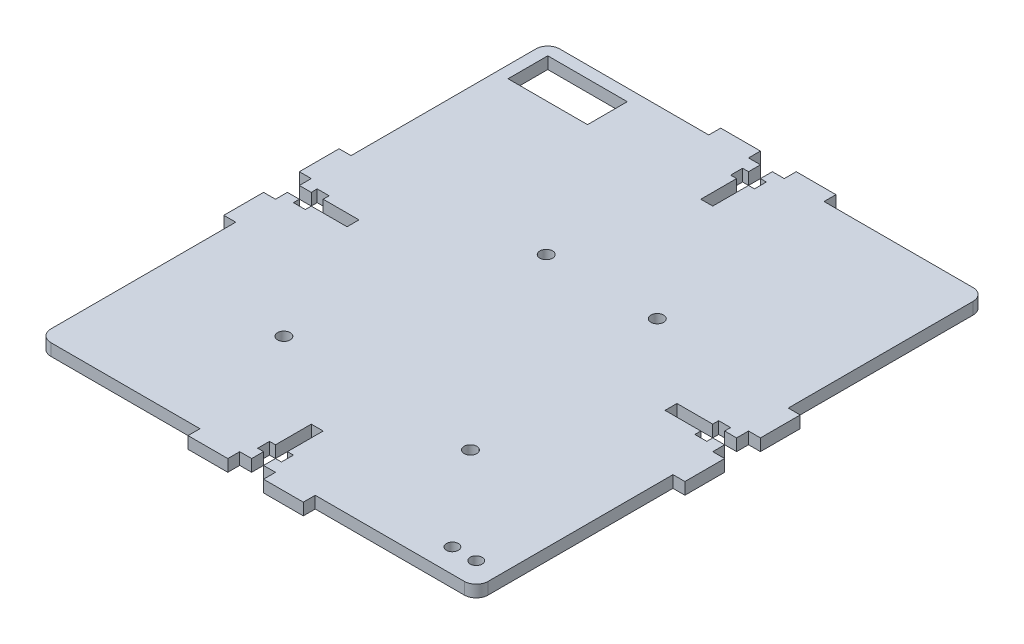
from build123d import *

# Parameters (mm, degrees)
SKETCH1_W           = 3
SKETCH1_H           = 10
SKETCH1_W_2         = 10
SKETCH1_H_2         = 3
BOSS_EXTRUDE2_DEPTH = 3
FILLET1_R           = 3
SKETCH2_R           = 1.6
CUT_EXTRUDE1_DEPTH  = 3
SKETCH3_R           = 1.5
CUT_EXTRUDE2_DEPTH  = 10
SKETCH4_W           = 20
SKETCH4_H           = 10
CUT_EXTRUDE3_DEPTH  = 10


with BuildPart() as part:
    # Sketch1 → Boss-Extrude2 (new body)
    with BuildSketch(Plane(origin=(0, 0, 0), x_dir=(1, 0, 0), z_dir=(0, 1, 0))):
        Polygon((0, 49.5), (0, 0), (40.5, 0), (50.5, 0), (53.5, 0), (53.5, 3), (52, 3), (52, 6), (53.5, 6), (53.5, 15), (56.5, 15), (56.5, 6), (58, 6), (58, 3), (56.5, 3), (56.5, 0), (59.5, 0), (69.5, 0), (110, 0), (110, 49.5), (110, 59.5), (110, 62.5), (107, 62.5), (107, 61), (104, 61), (104, 62.5), (95, 62.5), (95, 65.5), (104, 65.5), (104, 67), (107, 67), (107, 65.5), (110, 65.5), (110, 68.5), (110, 78.5), (110, 128), (69.5, 128), (59.5, 128), (56.5, 128), (56.5, 125), (58, 125), (58, 122), (56.5, 122), (56.5, 113), (53.5, 113), (53.5, 122), (52, 122), (52, 125), (53.5, 125), (53.5, 128), (50.5, 128), (40.5, 128), (0, 128), (0, 78.5), (0, 68.5), (0, 65.5), (3, 65.5), (3, 67), (6, 67), (6, 65.5), (15, 65.5), (15, 62.5), (6, 62.5), (6, 61), (3, 61), (3, 62.5), (0, 62.5), (0, 59.5), align=None)
        with Locations((111.5, 73.5)):
            Rectangle(SKETCH1_W, SKETCH1_H)
        with Locations((-1.5, 54.5)):
            Rectangle(SKETCH1_W, SKETCH1_H)
        with Locations((-1.5, 73.5)):
            Rectangle(SKETCH1_W, SKETCH1_H)
        with Locations((45.5, -1.5)):
            Rectangle(SKETCH1_W_2, SKETCH1_H_2)
        with Locations((45.5, 129.5)):
            Rectangle(SKETCH1_W_2, SKETCH1_H_2)
        with Locations((64.5, 129.5)):
            Rectangle(SKETCH1_W_2, SKETCH1_H_2)
        with Locations((64.5, -1.5)):
            Rectangle(SKETCH1_W_2, SKETCH1_H_2)
        with Locations((111.5, 54.5)):
            Rectangle(SKETCH1_W, SKETCH1_H)
    extrude(amount=BOSS_EXTRUDE2_DEPTH)

    # Fillet1
    fillet1_edges = [part.edges().sort_by_distance(p)[0] for p in [
        (0, 1.5, 0),
        (0, 1.5, -128),
        (110, 1.5, -128),
        (110, 1.5, 0),
    ]]
    fillet(fillet1_edges, radius=FILLET1_R)

    # Sketch2 → Cut-Extrude1 (cut)
    with BuildSketch(Plane(origin=(0, 3, 0), x_dir=(1, 0, 0), z_dir=(0, 1, 0))):
        with Locations(Location((74.05, 81.5, 0), (0, 0, 270))):
            Circle(SKETCH2_R)
        with Locations(Location((46.11, 81.5, 0), (0, 0, 270))):
            Circle(SKETCH2_R)
        with Locations(Location((79.15, 29.4, 0), (0, 0, 270))):
            Circle(SKETCH2_R)
        with Locations(Location((30.91, 30.7, 0), (0, 0, 270))):
            Circle(SKETCH2_R)
    extrude(amount=-CUT_EXTRUDE1_DEPTH, mode=Mode.SUBTRACT)

    # Sketch3 → Cut-Extrude2 (cut)
    with BuildSketch(Plane(origin=(0, 3, 0), x_dir=(1, 0, 0), z_dir=(0, 1, 0))):
        with Locations(Location((98, 6, 0), (0, 0, 270))):
            Circle(SKETCH3_R)
        with Locations(Location((104, 6, 0), (0, 0, 270))):
            Circle(SKETCH3_R)
    extrude(amount=-CUT_EXTRUDE2_DEPTH, mode=Mode.SUBTRACT)

    # Sketch4 → Cut-Extrude3 (cut)
    with BuildSketch(Plane(origin=(0, 3, 0), x_dir=(1, 0, 0), z_dir=(0, 1, 0))):
        with Locations((13, 120)):
            Rectangle(SKETCH4_W, SKETCH4_H)
    extrude(amount=-CUT_EXTRUDE3_DEPTH, mode=Mode.SUBTRACT)


solid = part.part
